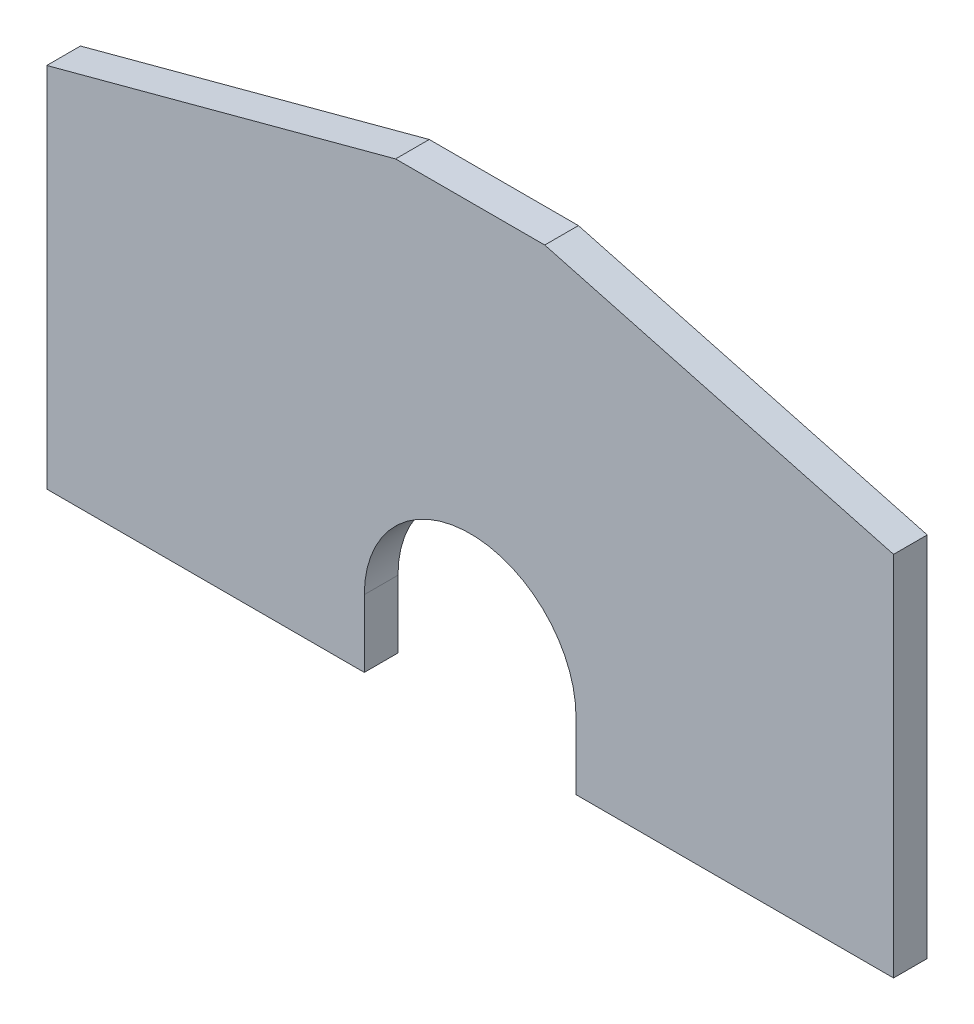
from build123d import *

# Parameters (mm, degrees)
AUFSATZ_LINEAR_AUSTRAGEN1_DEPTH = 35


with BuildPart() as part:
    # Skizze1 → Aufsatz-Linear austragen1 (new body)
    with BuildSketch(Plane.XY):
        with BuildLine():
            Line((62.877451446, 389.076644167), (62.877451446, 7.806644167))
            Line((62.877451446, 7.806644167), (-267.122548554, 7.806644167))
            Line((-267.122548554, 7.806644167), (-267.122548554, 77.806644167))
            ThreePointArc((-267.122548554, 77.806644167), (-377.122548554, 187.806644167), (-487.122548554, 77.806644167))
            Line((-487.122548554, 77.806644167), (-487.122548554, 7.806644167))
            Line((-487.122548554, 7.806644167), (-817.122548554, 7.806644167))
            Line((-817.122548554, 7.806644167), (-817.122548554, 389.076644167))
            Line((-817.122548554, 389.076644167), (-454.622548554, 486.208226423))
            Line((-454.622548554, 486.208226423), (-299.622548554, 486.208226423))
            Line((-299.622548554, 486.208226423), (62.877451446, 389.076644167))
        make_face()
    extrude(amount=AUFSATZ_LINEAR_AUSTRAGEN1_DEPTH)


solid = part.part
